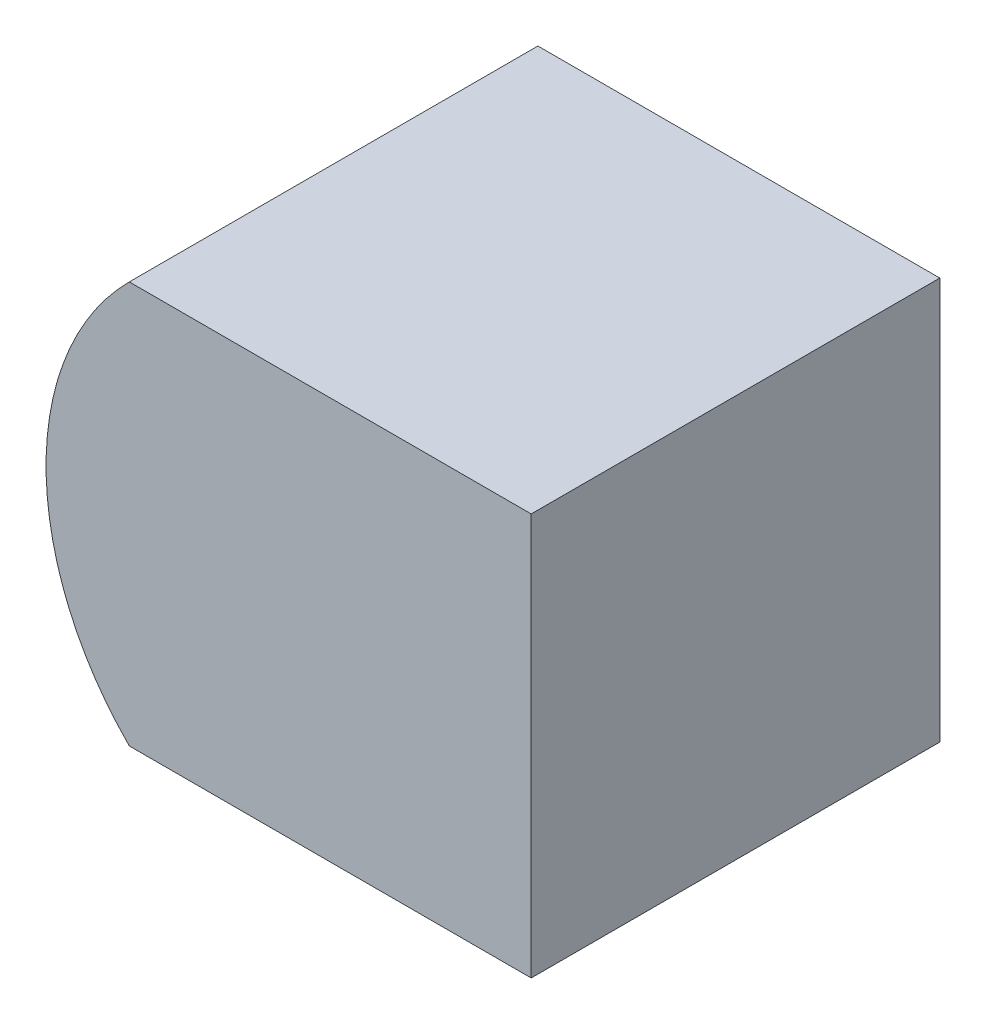
from build123d import *

# Parameters (mm, degrees)
BOSS_EXTRUDE1_DEPTH = 61


with BuildPart() as part:
    # Sketch1 → Boss-Extrude1 (new body)
    with BuildSketch(Plane.XY):
        with BuildLine():
            Line((-30, 30), (30, 30))
            Line((30, 30), (30, -30))
            Line((30, -30), (-30, -30))
            ThreePointArc((-30, -30), (-42.426406871, 0), (-30, 30))
        make_face()
    extrude(amount=BOSS_EXTRUDE1_DEPTH)


solid = part.part
